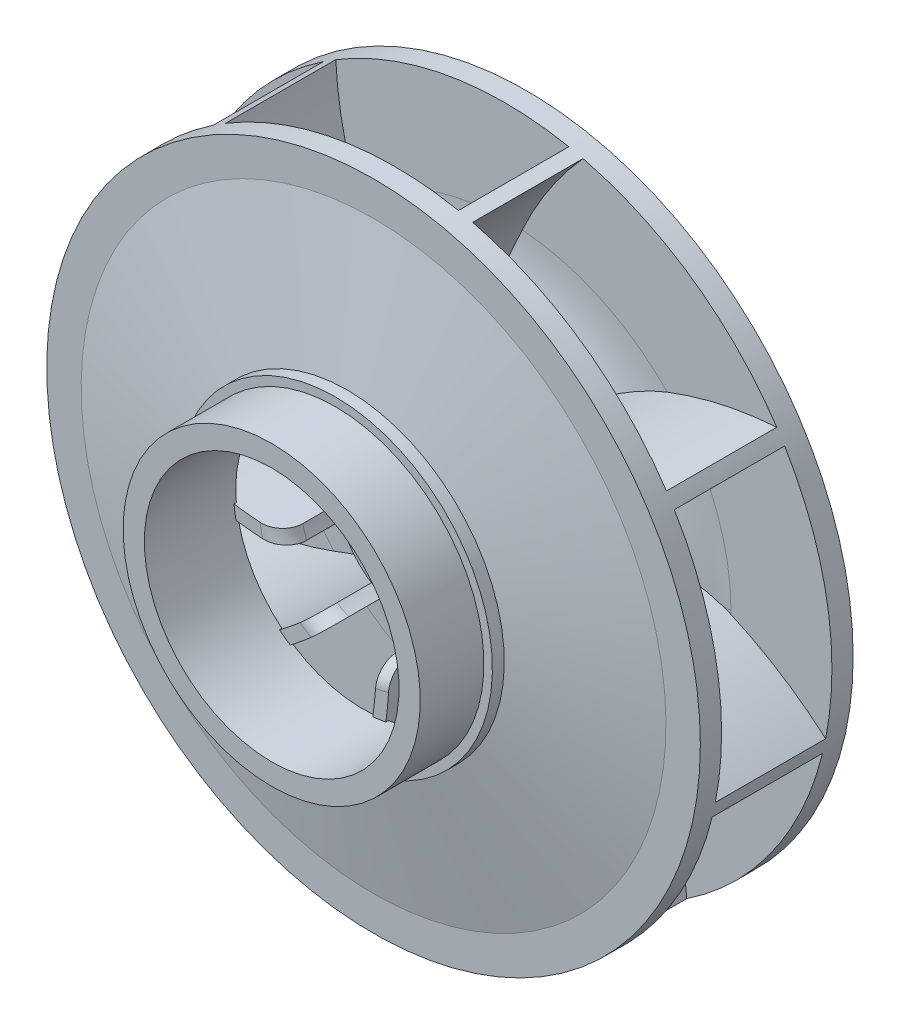
from build123d import *

# Parameters (mm, degrees)
BOSS_EXTRUDE1_START      = 34
BOSS_EXTRUDE1_DEPTH      = 34
FILLET1_R                = 5
CIRPATTERN1_COUNT        = 8
FILLET1_OF_CIRPATTERN1_R = 5
CUT_EXTRUDE1_REACH       = 120.604
SKETCH5_W                = 6
SKETCH5_H                = 5


with BuildPart() as part:
    # Sketch1 → Revolve1 (revolve)
    with BuildSketch(Plane(origin=(0, 0, 0), x_dir=(0, 0, -1), z_dir=(1, 0, 0)), mode=Mode.PRIVATE) as revolve1_sk:
        with BuildLine():
            Line((0, 17.5), (0, 9))
            Line((0, 9), (32, 9))
            Line((32, 9), (32, 22))
            Line((32, 22), (27, 22))
            Line((27, 22), (27, 36))
            Line((27, 36), (32, 36))
            Line((32, 36), (32, 37.5))
            Line((32, 37.5), (47, 37.5))
            Line((47, 37.5), (47, 42.5))
            Line((47, 42.5), (27, 42.5))
            Line((27, 42.5), (27, 77))
            Line((27, 77), (22, 77))
            Line((22, 77), (22, 53.221142199))
            ThreePointArc((22, 53.221142199), (16.058772732, 32.244965236), (0, 17.5))
        make_face()
    revolve(revolve1_sk.sketch.rotate(Axis((0, 0, 0), (0, 0, -1)), 90), axis=Axis((0, 0, 0), (0, 0, -1)))

    # Sketch2 → Boss-Extrude1 (add)
    with BuildSketch(Plane.XY.offset(-22).offset(BOSS_EXTRUDE1_START)):
        with BuildLine():
            ThreePointArc((40.377989478, 34.671428333), (52.916096989, 38.26548059), (65.85646563, 39.898946536))
            ThreePointArc((65.85646563, 39.898946536), (64.950250141, 41.357768395), (64.011725077, 42.796016786))
            ThreePointArc((64.011725077, 42.796016786), (50.890406358, 40.900078177), (38.2028132, 37.054487456))
            ThreePointArc((38.2028132, 37.054487456), (39.308464484, 35.879445326), (40.377989478, 34.671428333))
        make_face()
        with BuildLine():
            ThreePointArc((10.580785698, 15.781222197), (24.488519014, 26.789310475), (40.377989478, 34.671428333))
            ThreePointArc((40.377989478, 34.671428333), (39.308464484, 35.879445326), (38.2028132, 37.054487456))
            ThreePointArc((38.2028132, 37.054487456), (22.000000328, 28.756355872), (7.851258512, 17.301957686))
            ThreePointArc((7.851258512, 17.301957686), (9.24733597, 16.597794355), (10.580785698, 15.781222197))
        make_face()
    boss_extrude1 = extrude(amount=-BOSS_EXTRUDE1_DEPTH)

    # Fillet1
    fillet1_edges = [part.edges().sort_by_distance(p)[0] for p in [
        (9.24733597, 16.597794355, 12),
    ]]
    fillet(fillet1_edges, radius=FILLET1_R)

    # CirPattern1: Boss-Extrude1 ×8 about axis
    cirpattern1_axis = Axis((0, 0, 0), (0, 0, 1))
    for i in range(1, CIRPATTERN1_COUNT):
        add(boss_extrude1.rotate(cirpattern1_axis, i * 360 / CIRPATTERN1_COUNT))

    # Fillet1 of CirPattern1
    fillet1_of_cirpattern1_edges = [part.edges().sort_by_distance(p)[0] for p in [
        (-5.197558969, 18.275266914, 12),
        (-16.597794355, 9.24733597, 12),
        (-18.275266914, -5.197558969, 12),
        (-9.24733597, -16.597794355, 12),
        (5.197558969, -18.275266914, 12),
        (16.597794355, -9.24733597, 12),
        (18.275266914, 5.197558969, 12),
    ]]
    fillet(fillet1_of_cirpattern1_edges, radius=FILLET1_OF_CIRPATTERN1_R)

    # Sketch3 → Revolve2 (revolve)
    with BuildSketch(Plane(origin=(0, 0, 0), x_dir=(0, 0, -1), z_dir=(1, 0, 0)), mode=Mode.PRIVATE) as revolve2_sk:
        Polygon((-33, 35), (-33, 30), (-11.467078689, 30), (-4, 68.414789658), (-4, 77), (-9, 77), (-9, 68.896234899), (-15.2, 37), (-18, 37), (-18, 35), align=None)
    revolve(revolve2_sk.sketch.rotate(Axis((0, 0, 0), (0, 0, 1)), 270), axis=Axis((0, 0, 0), (0, 0, 1)))

    # Sketch4 → Cut-Revolve1 (revolve, cut)
    with BuildSketch(Plane(origin=(0, 0, 0), x_dir=(0, 0, -1), z_dir=(1, 0, 0)), mode=Mode.PRIVATE) as cut_revolve1_sk:
        Polygon((-15.2, 37), (-15.2, 77), (-9, 77), (-9, 68.896234899), align=None)
    revolve(cut_revolve1_sk.sketch.rotate(Axis((0, 0, 0), (0, 0, 1)), 270), axis=Axis((0, 0, 0), (0, 0, 1)), mode=Mode.SUBTRACT)

    # Sketch5 → Cut-Extrude1 (cut, up to next)
    with BuildSketch(Plane.XY, mode=Mode.PRIVATE) as cut_extrude1_sk1:
        with Locations((0, 9.3)):
            Rectangle(SKETCH5_W, SKETCH5_H)
    cut_extrude1_tool1 = extrude(cut_extrude1_sk1.sketch, amount=-CUT_EXTRUDE1_REACH, mode=Mode.PRIVATE) & part.part
    add(cut_extrude1_tool1.solids().sort_by_distance((0, 9.3, 0))[0], mode=Mode.SUBTRACT)


solid = part.part
